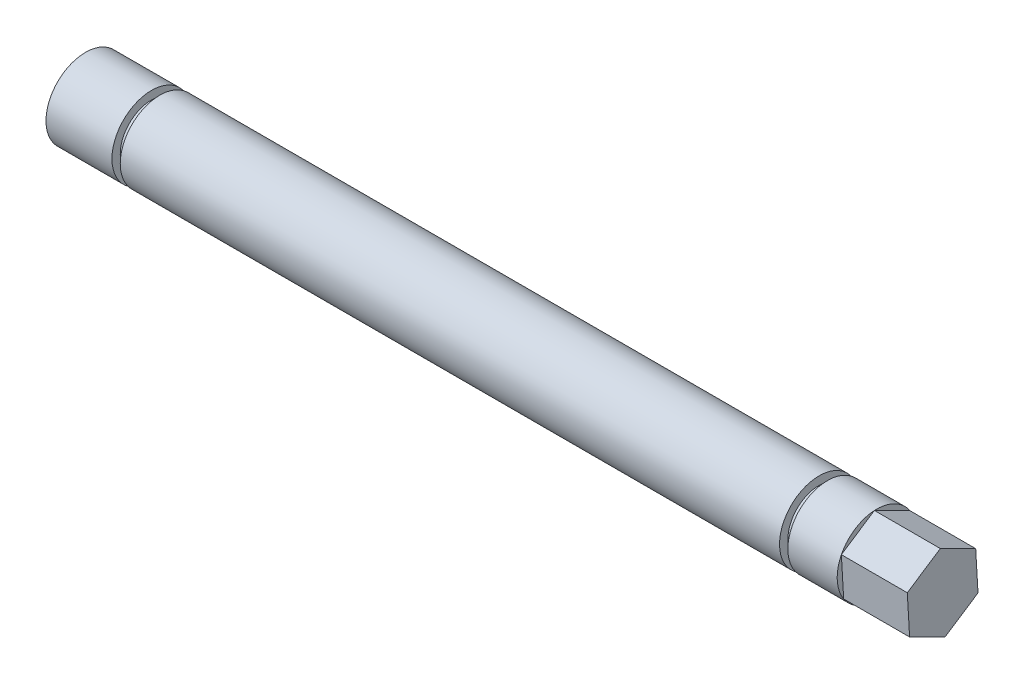
from build123d import *

# Parameters (mm, degrees)
SKETCH2_R           = 7.62
BOSS_EXTRUDE1_DEPTH = 165.1
SKETCH3_W           = 1.6002
SKETCH3_H           = 1.6002
SKETCH4_R           = 7.62
SKETCH4_R_2         = 6.0198
CUT_EXTRUDE1_DEPTH  = 1.6002
SKETCH5_OUTSIDE_W   = 50.54
SKETCH5_OUTSIDE_H   = 50.54
CUT_EXTRUDE2_DEPTH  = 12.7


with BuildPart() as part:
    # Sketch2 → Boss-Extrude1 (new body)
    with BuildSketch(Plane(origin=(0, 0, 0), x_dir=(0, 0, -1), z_dir=(1, 0, 0))):
        Circle(SKETCH2_R)
    extrude(amount=BOSS_EXTRUDE1_DEPTH)

    # Sketch3 → Cut-Revolve1 (revolve, cut)
    with BuildSketch(Plane.XY, mode=Mode.PRIVATE) as cut_revolve1_sk:
        with Locations((13.5001, 6.8199)):
            Rectangle(SKETCH3_W, SKETCH3_H)
    revolve(cut_revolve1_sk.sketch.rotate(Axis((0, 0, 0), (1, 0, 0)), 90), axis=Axis((0, 0, 0), (1, 0, 0)), mode=Mode.SUBTRACT)

    # Sketch4 → Cut-Extrude1 (cut)
    with BuildSketch(Plane.ZY.offset(-141.3002)):
        Circle(SKETCH4_R)
        Circle(SKETCH4_R_2, mode=Mode.SUBTRACT)
    extrude(amount=-CUT_EXTRUDE1_DEPTH, mode=Mode.SUBTRACT)

    # Sketch5 outside → Cut-Extrude2 (cut)
    with BuildSketch(Plane(origin=(165.1, 0, 0), x_dir=(0, 0, -1), z_dir=(1, 0, 0))):
        Rectangle(SKETCH5_OUTSIDE_W, SKETCH5_OUTSIDE_H)
        Polygon((6.366186157, 4.187609558), (-0.44348318, 7.607083716), (-6.809669337, 3.419474158), (-6.366186157, -4.187609558), (0.44348318, -7.607083716), (6.809669337, -3.419474158), align=None, mode=Mode.SUBTRACT)
    extrude(amount=-CUT_EXTRUDE2_DEPTH, mode=Mode.SUBTRACT)


solid = part.part
